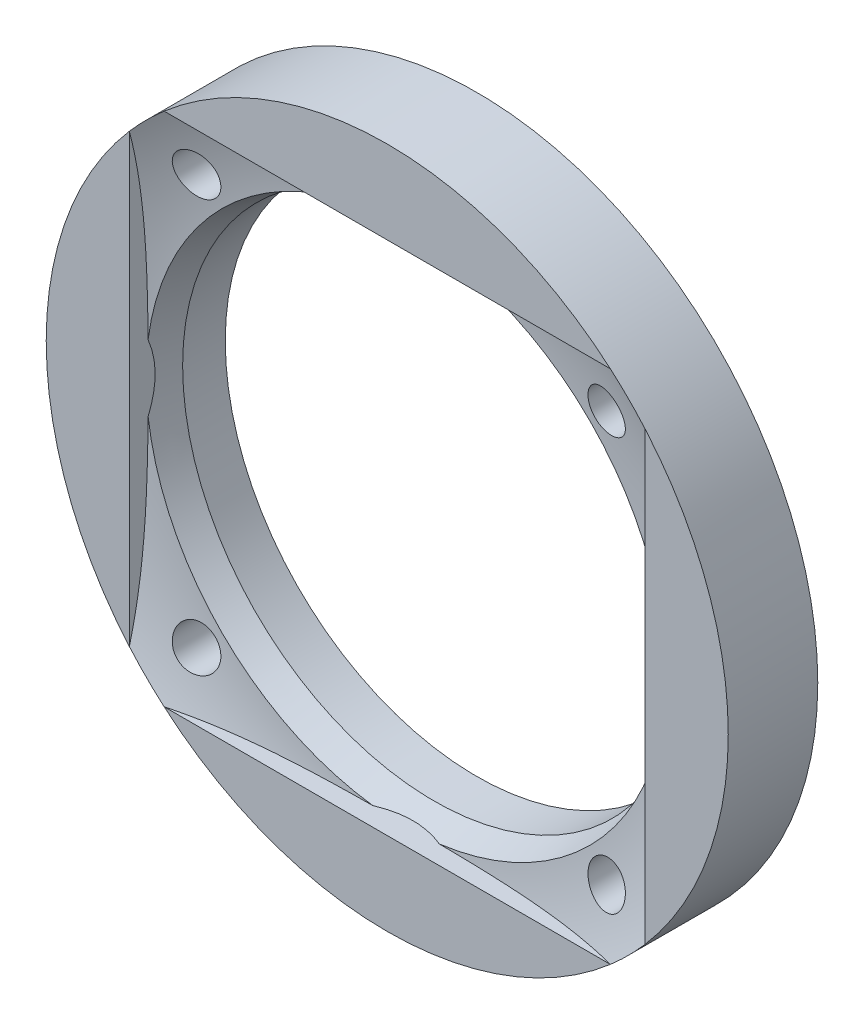
from build123d import *

# Parameters (mm, degrees)
SKETCH2_R           = 2.5
CUT_EXTRUDE2_DEPTH  = 58.534772252
BOSS_EXTRUDE1_START = -10.5
BOSS_EXTRUDE1_DEPTH = 10.5


with BuildPart() as part:
    # Sketch1 → Revolve1 (revolve)
    with BuildSketch(Plane(origin=(0, 0, 0), x_dir=(1, 0, 0), z_dir=(0, 1, 0)), mode=Mode.PRIVATE) as revolve1_sk:
        with BuildLine():
            Line((29.5, 0), (40, 0))
            Line((40, 0), (40, -10.5))
            ThreePointArc((40, -10.5), (35.334867618, -9.033526194), (30.5, -8.3))
            Line((30.5, -8.3), (29.5, -5))
            Line((29.5, -5), (29.5, 0))
        make_face()
    revolve(revolve1_sk.sketch.rotate(Axis((0, 0, 0), (0, 0, 1)), 180), axis=Axis((0, 0, 0), (0, 0, 1)))

    # Sketch2 → Cut-Extrude2 (cut, through all)
    with BuildSketch(Plane(origin=(0, 0, 0), x_dir=(-1, 0, 0), z_dir=(0, 0, -1))):
        with Locations((24.04163056, 24.04163056)):
            Circle(SKETCH2_R)
        with Locations((24.04163056, -24.04163056)):
            Circle(SKETCH2_R)
        with Locations((-24.04163056, -24.04163056)):
            Circle(SKETCH2_R)
        with Locations((-24.04163056, 24.04163056)):
            Circle(SKETCH2_R)
    extrude(amount=-CUT_EXTRUDE2_DEPTH, mode=Mode.SUBTRACT)

    # Sketch4 → Boss-Extrude1 (add)
    with BuildSketch(Plane(origin=(0, 0, 0), x_dir=(-1, 0, 0), z_dir=(0, 0, -1)).offset(BOSS_EXTRUDE1_START)):
        with BuildLine():
            Line((-26.171310628, 30.25), (26.171310628, 30.25))
            ThreePointArc((26.171310628, 30.25), (0, 40), (-26.171310628, 30.25))
        make_face()
        with BuildLine():
            Line((-30.25, 26.171310628), (-30.25, -26.171310628))
            ThreePointArc((-30.25, -26.171310628), (-40, 0), (-30.25, 26.171310628))
        make_face()
        with BuildLine():
            Line((-26.171310628, -30.25), (26.171310628, -30.25))
            ThreePointArc((26.171310628, -30.25), (0, -40), (-26.171310628, -30.25))
        make_face()
        with BuildLine():
            Line((30.25, 26.171310628), (30.25, -26.171310628))
            ThreePointArc((30.25, -26.171310628), (40, 0), (30.25, 26.171310628))
        make_face()
    extrude(amount=BOSS_EXTRUDE1_DEPTH)


solid = part.part
